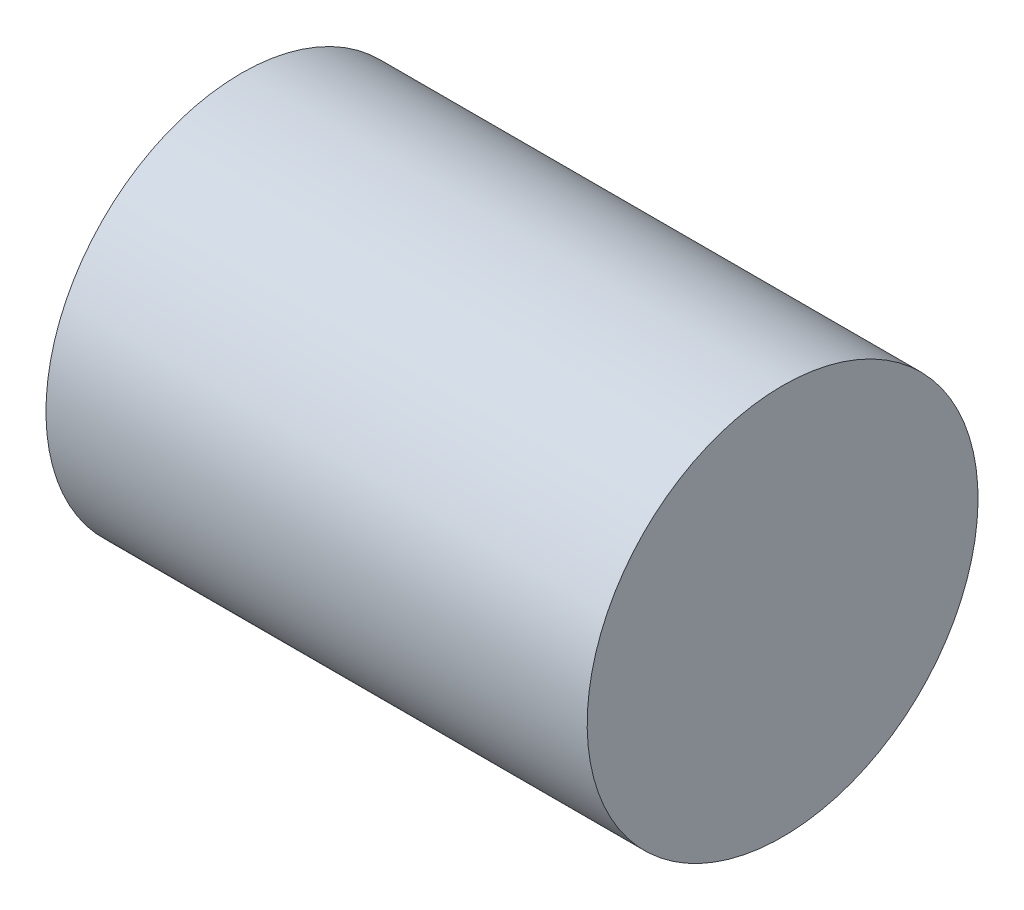
from build123d import *

# Parameters (mm, degrees)
SKETCH1_W = 180
SKETCH1_H = 65


with BuildPart() as part:
    # Sketch1 → Revolve1 (revolve)
    with BuildSketch(Plane.XY):
        with Locations((90, 32.5)):
            Rectangle(SKETCH1_W, SKETCH1_H)
    revolve(axis=Axis((180, 0, 0), (-1, 0, 0)))


solid = part.part
